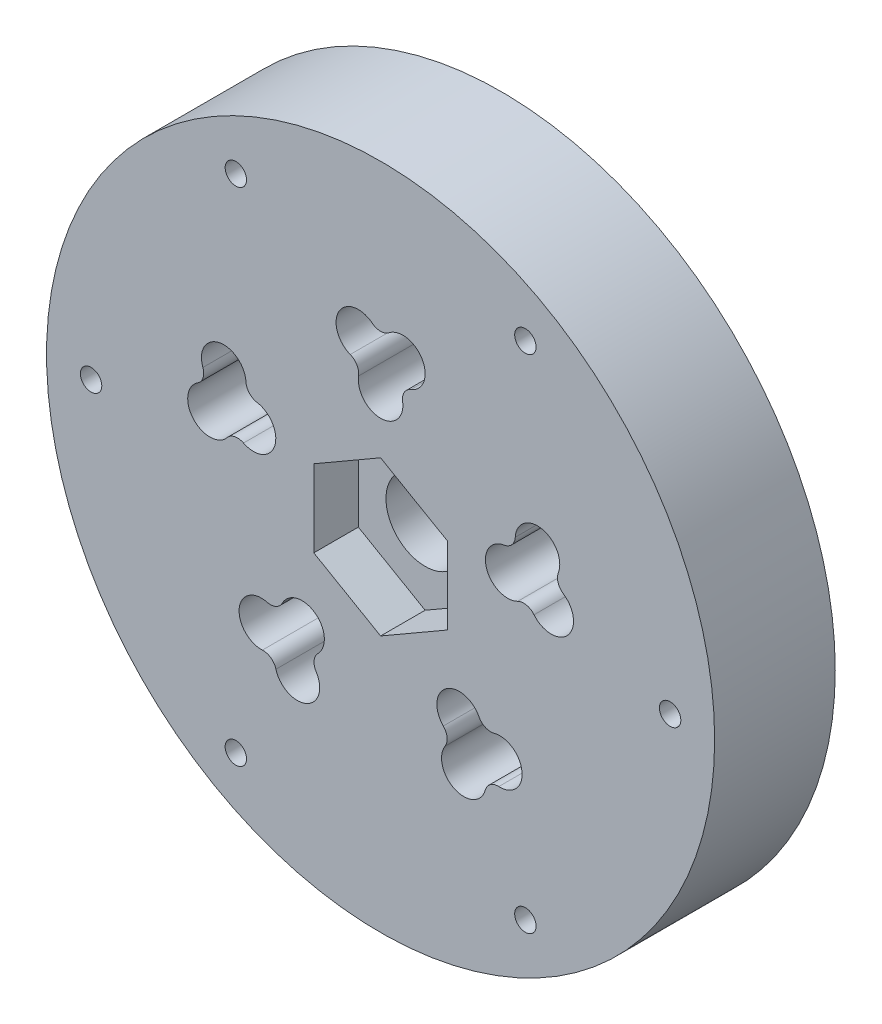
from build123d import *

# Parameters (mm, degrees)
ESBO_O1_R                        = 75
RESSALTO_EXTRUS_O1_DEPTH         = 27.075013067
ESBO_O2_R                        = 8.8
CORTE_EXTRUS_O1_DEPTH            = 110.467147275
CORTE_EXTRUS_O2_DEPTH            = 10
REBAIXO_PARA_SHCS_M41_AT_2_COUNT = 2
REBAIXO_PARA_SHCS_M41_AT_2_PITCH = 65
REBAIXO_PARA_SHCS_M41_AT_3_COUNT = 2
REBAIXO_PARA_SHCS_M41_AT_3_PITCH = 112.583302492
REBAIXO_PARA_SHCS_M41_AT_4_COUNT = 2
REBAIXO_PARA_SHCS_M41_AT_4_PITCH = 130
REBAIXO_PARA_SHCS_M41_AT_5_COUNT = 2
REBAIXO_PARA_SHCS_M41_AT_5_PITCH = 65
REBAIXO_PARA_SHCS_M41_AT_6_COUNT = 2
REBAIXO_PARA_SHCS_M41_AT_6_PITCH = 112.583302492
CORTE_EXTRUS_O3_DEPTH            = 110.467147275
PADR_OCIRCULAR1_COUNT            = 5
ESBO_O9_R                        = 4


with BuildPart() as part:
    # Esboço1 → Ressalto-extrusão1 (new body)
    with BuildSketch(Plane.XY):
        Circle(ESBO_O1_R)
    extrude(amount=-RESSALTO_EXTRUS_O1_DEPTH)

    # Esboço2 → Corte-extrusão1 (cut, through all)
    with BuildSketch(Plane.XY):
        Circle(ESBO_O2_R)
    extrude(amount=-CORTE_EXTRUS_O1_DEPTH, mode=Mode.SUBTRACT)

    # Esboço3 → Corte-extrusão2 (cut)
    with BuildSketch(Plane.XY):
        Polygon((0, 17.320508076), (-15, 8.660254038), (-15, -8.660254038), (0, -17.320508076), (15, -8.660254038), (15, 8.660254038), align=None)
    extrude(amount=-CORTE_EXTRUS_O2_DEPTH, mode=Mode.SUBTRACT)

    # Esboço5 → Rebaixo para SHCS M41 (revolve, cut)
    with BuildSketch(Plane(origin=(65, 0, -27.075013067), x_dir=(0, 1, 0), z_dir=(1, 0, 0))):
        Polygon((0, 0), (0, 27.075013067), (2.4, 27.075013067), (2.4, 4), (4, 4), (4, 0.025), (4.025, 0), align=None)
    rebaixo_para_shcs_m41 = revolve(axis=Axis((65, 0, -33.425013067), (0, 0, 1)), mode=Mode.SUBTRACT)

    # Rebaixo para SHCS M41 at 2: Rebaixo para SHCS M41 ×2
    with Locations(*[Vector(-0.49999999999999795, 0.8660254037844399, 0) * (i * REBAIXO_PARA_SHCS_M41_AT_2_PITCH) for i in range(1, REBAIXO_PARA_SHCS_M41_AT_2_COUNT)]):
        add(rebaixo_para_shcs_m41, mode=Mode.SUBTRACT)

    # Rebaixo para SHCS M41 at 3: Rebaixo para SHCS M41 ×2
    with Locations(*[Vector(-0.866025403784438, 0.500000000000001, 0) * (i * REBAIXO_PARA_SHCS_M41_AT_3_PITCH) for i in range(1, REBAIXO_PARA_SHCS_M41_AT_3_COUNT)]):
        add(rebaixo_para_shcs_m41, mode=Mode.SUBTRACT)

    # Rebaixo para SHCS M41 at 4: Rebaixo para SHCS M41 ×2
    with Locations(*[(-i * REBAIXO_PARA_SHCS_M41_AT_4_PITCH, 0, 0) for i in range(1, REBAIXO_PARA_SHCS_M41_AT_4_COUNT)]):
        add(rebaixo_para_shcs_m41, mode=Mode.SUBTRACT)

    # Rebaixo para SHCS M41 at 5: Rebaixo para SHCS M41 ×2
    with Locations(*[Vector(-0.500000000000004, -0.8660254037844364, 0) * (i * REBAIXO_PARA_SHCS_M41_AT_5_PITCH) for i in range(1, REBAIXO_PARA_SHCS_M41_AT_5_COUNT)]):
        add(rebaixo_para_shcs_m41, mode=Mode.SUBTRACT)

    # Rebaixo para SHCS M41 at 6: Rebaixo para SHCS M41 ×2
    with Locations(*[Vector(-0.8660254037844416, -0.499999999999995, 0) * (i * REBAIXO_PARA_SHCS_M41_AT_6_PITCH) for i in range(1, REBAIXO_PARA_SHCS_M41_AT_6_COUNT)]):
        add(rebaixo_para_shcs_m41, mode=Mode.SUBTRACT)

    # Esboço6 → Corte-extrusão3 (cut, through all)
    with BuildSketch(Plane(origin=(0, 0, -27.075013067), x_dir=(-1, 0, 0), z_dir=(0, 0, -1))):
        with BuildLine():
            ThreePointArc((-1.875, 42.563377787), (-9.330127019, 41.160254038), (-6.817704321, 34.002362777))
            ThreePointArc((-6.817704321, 34.002362777), (-5.310250702, 32.70762802), (-4.942704321, 30.754767512))
            ThreePointArc((-4.942704321, 30.754767512), (0, 25), (4.942704321, 30.754767512))
            ThreePointArc((4.942704321, 30.754767512), (5.310250702, 32.70762802), (6.817704321, 34.002362777))
            ThreePointArc((6.817704321, 34.002362777), (9.330127019, 41.160254038), (1.875, 42.563377787))
            ThreePointArc((1.875, 42.563377787), (0, 41.905252036), (-1.875, 42.563377787))
        make_face()
    corte_extrus_o3 = extrude(amount=-CORTE_EXTRUS_O3_DEPTH, mode=Mode.SUBTRACT)

    # PadrãoCircular1: Corte-extrusão3 ×5 about axis
    padr_ocircular1_axis = Axis((0, 0, 0), (0, 0, 1))
    for i in range(1, PADR_OCIRCULAR1_COUNT):
        add(corte_extrus_o3.rotate(padr_ocircular1_axis, i * 360 / PADR_OCIRCULAR1_COUNT), mode=Mode.SUBTRACT)

    # Esboço9 → Corte-Revolução1 (revolve, cut)
    with BuildSketch(Plane(origin=(0, 0, 0), x_dir=(1, 0, 0), z_dir=(0, 1, 0)), mode=Mode.PRIVATE) as corte_revolu_o1_sk:
        with Locations((-53.5, 27.075013067)):
            Circle(ESBO_O9_R)
    revolve(corte_revolu_o1_sk.sketch.rotate(Axis((0, 0, -10), (0, 0, -1)), 180), axis=Axis((0, 0, -10), (0, 0, -1)), mode=Mode.SUBTRACT)


solid = part.part
